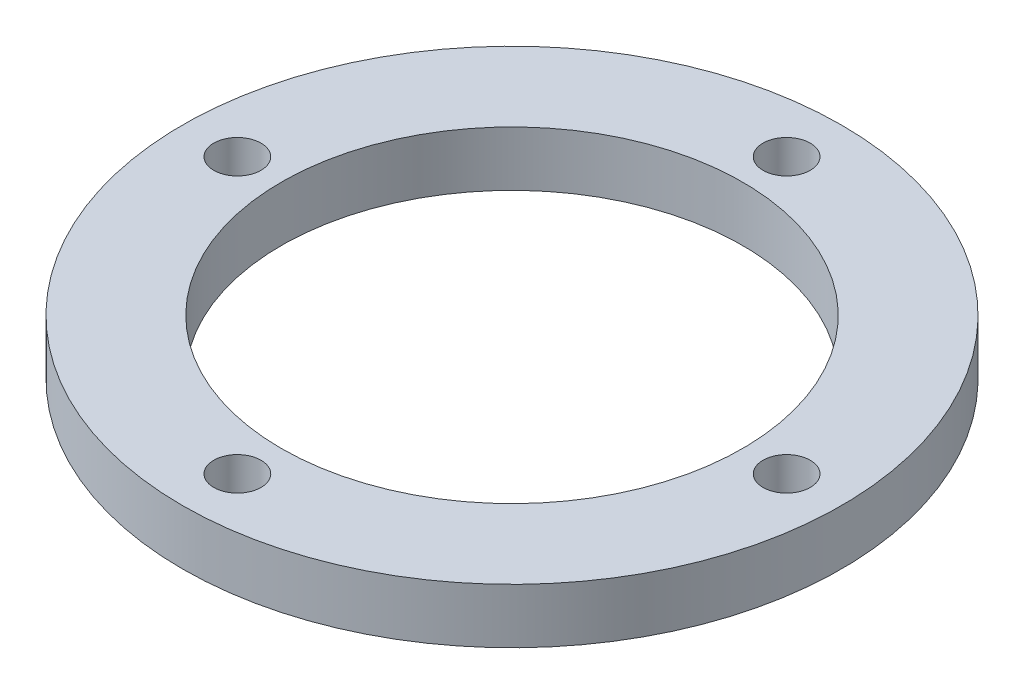
from build123d import *

# Parameters (mm, degrees)
SKETCH1_R            = 30
SKETCH1_R_2          = 21
BOSS_EXTRUDE1_DEPTH  = 5
M4_CLEARANCE_HOLE1_D = 4.3


with BuildPart() as part:
    # Sketch1 → Boss-Extrude1 (new body)
    with BuildSketch(Plane(origin=(0, 0, 0), x_dir=(1, 0, 0), z_dir=(0, 1, 0))):
        with Locations(Location((0, 0, 0), (0, 0, 270))):
            Circle(SKETCH1_R)
        with Locations(Location((0, 0, 0), (0, 0, 270))):
            Circle(SKETCH1_R_2, mode=Mode.SUBTRACT)
    extrude(amount=BOSS_EXTRUDE1_DEPTH)

    # M4 Clearance Hole1 (through all)
    with Locations(Plane(origin=(0, 5, 0), x_dir=(1, 0, 0), z_dir=(0, 1, 0))):
        with Locations((0, -25), (0, 25), (25, 0), (-25, 0)):
            Hole(M4_CLEARANCE_HOLE1_D / 2)


solid = part.part
